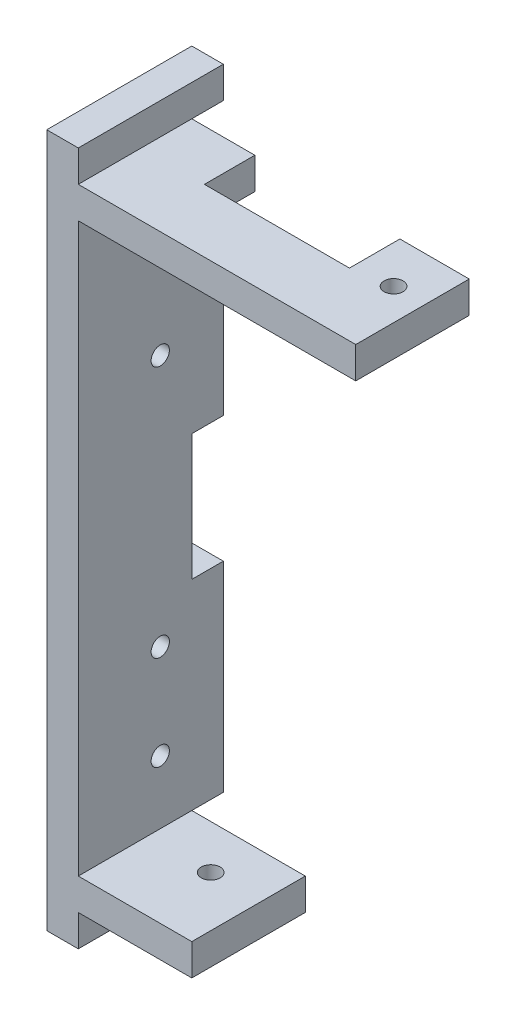
from build123d import *

# Parameters (mm, degrees)
EXTRUDE_1_DEPTH     = 23
SKETCH_2_W          = 5
SKETCH_2_H          = 20
CUT_EXTRUDE_1_DEPTH = 5
CUT_EXTRUDE_2_REACH = 112.72
SKETCH_4_W          = 23
SKETCH_4_H          = 13
CUT_EXTRUDE_3_REACH = 112.72
SKETCH_3_R          = 1.5
SKETCH_7_R          = 1.5
CUT_EXTRUDE_4_DEPTH = 111.719601125
SKETCH_8_W          = 76.143558985
SKETCH_8_H          = 113.649709854
CUT_EXTRUDE_5_DEPTH = 5
SKETCH_9_W          = 28.016263666
SKETCH_9_H          = 5
SKETCH_9_W_2        = 40.160076627
CUT_EXTRUDE_6_DEPTH = 5
SKETCH_10_R         = 1.45
CUT_EXTRUDE_7_DEPTH = 114.977488026


with BuildPart() as part:
    # 草圖1 → 填料-伸長1 (new body)
    with BuildSketch(Plane.XY):
        Polygon((-17.451364004, -4.696122823), (-17.451364004, -9.696122823), (-22.451364004, -9.696122823), (-22.451364004, 100.303877177), (-17.451364004, 100.303877177), (-17.451364004, 95.303877177), (26.548635996, 95.303877177), (26.548635996, 90.303877177), (-17.451364004, 90.303877177), (-17.451364004, 0.303877177), (0.548635996, 0.303877177), (0.548635996, -4.696122823), align=None)
    extrude(amount=EXTRUDE_1_DEPTH)

    # 草圖2 → 除料-伸長1 (cut)
    with BuildSketch(Plane(origin=(0, 0, 0), x_dir=(-1, 0, 0), z_dir=(0, 0, -1))):
        with Locations((19.951364004, 42.053877177)):
            Rectangle(SKETCH_2_W, SKETCH_2_H)
    extrude(amount=-CUT_EXTRUDE_1_DEPTH, mode=Mode.SUBTRACT)

    # 草圖4 → 除料-伸長2 (cut, up to next)
    with BuildSketch(Plane(origin=(0, 95.303877177, 0), x_dir=(1, 0, 0), z_dir=(0, 1, 0)), mode=Mode.PRIVATE) as cut_extrude_2_sk1:
        with Locations((4.048635996, -6.5)):
            Rectangle(SKETCH_4_W, SKETCH_4_H)
    cut_extrude_2_tool1 = extrude(cut_extrude_2_sk1.sketch, amount=-CUT_EXTRUDE_2_REACH, mode=Mode.PRIVATE) & part.part
    add(cut_extrude_2_tool1.solids().sort_by_distance((4.048636, 95.303877, 6.5))[0], mode=Mode.SUBTRACT)

    # 草圖3 → 除料-伸長3 (cut, up to next)
    with BuildSketch(Plane.XZ.offset(4.696122823), mode=Mode.PRIVATE) as cut_extrude_3_sk1:
        with Locations((-7.451364004, 12)):
            Circle(SKETCH_3_R)
    cut_extrude_3_tool1 = extrude(cut_extrude_3_sk1.sketch, amount=-CUT_EXTRUDE_3_REACH, mode=Mode.PRIVATE) & part.part
    add(cut_extrude_3_tool1.solids().sort_by_distance((-7.451364, -4.696123, 12))[0], mode=Mode.SUBTRACT)

    # 草圖7 → 除料-伸長4 (cut, through all)
    with BuildSketch(Plane(origin=(0, 95.303877177, 0), x_dir=(1, 0, 0), z_dir=(0, 1, 0))):
        with Locations(Location((21.548635996, -12, 0), (0, 0, 270))):
            Circle(SKETCH_7_R)
    extrude(amount=-CUT_EXTRUDE_4_DEPTH, mode=Mode.SUBTRACT)

    # 草圖8 → 除料-伸長5 (cut)
    with BuildSketch(Plane(origin=(0, 0, 0), x_dir=(-1, 0, 0), z_dir=(0, 0, -1))):
        with Locations((-20.620415489, 43.47902225)):
            Rectangle(SKETCH_8_W, SKETCH_8_H)
    extrude(amount=-CUT_EXTRUDE_5_DEPTH, mode=Mode.SUBTRACT)

    # 草圖9 → 除料-伸長6 (cut)
    with BuildSketch(Plane(origin=(0, 0, 0), x_dir=(-1, 0, 0), z_dir=(0, 0, -1))):
        with Locations((31.459495837, 92.803877177)):
            Rectangle(SKETCH_9_W, SKETCH_9_H)
        with Locations((37.531402318, -2.196122823)):
            Rectangle(SKETCH_9_W_2, SKETCH_9_H)
    extrude(amount=-CUT_EXTRUDE_6_DEPTH, mode=Mode.SUBTRACT)

    # 草圖10 → 除料-伸長7 (cut, through all)
    with BuildSketch(Plane.ZY.offset(22.451364004)):
        with Locations(Location((10, 80.303877177, 0), (0, 0, 270))):
            Circle(SKETCH_10_R)
        with Locations(Location((10, 10.303877177, 0), (0, 0, 270))):
            Circle(SKETCH_10_R)
        with Locations(Location((10, 65.303877177, 0), (0, 0, 270))):
            Circle(SKETCH_10_R)
        with Locations(Location((10, 25.303877177, 0), (0, 0, 270))):
            Circle(SKETCH_10_R)
    extrude(amount=-CUT_EXTRUDE_7_DEPTH, mode=Mode.SUBTRACT)


solid = part.part
